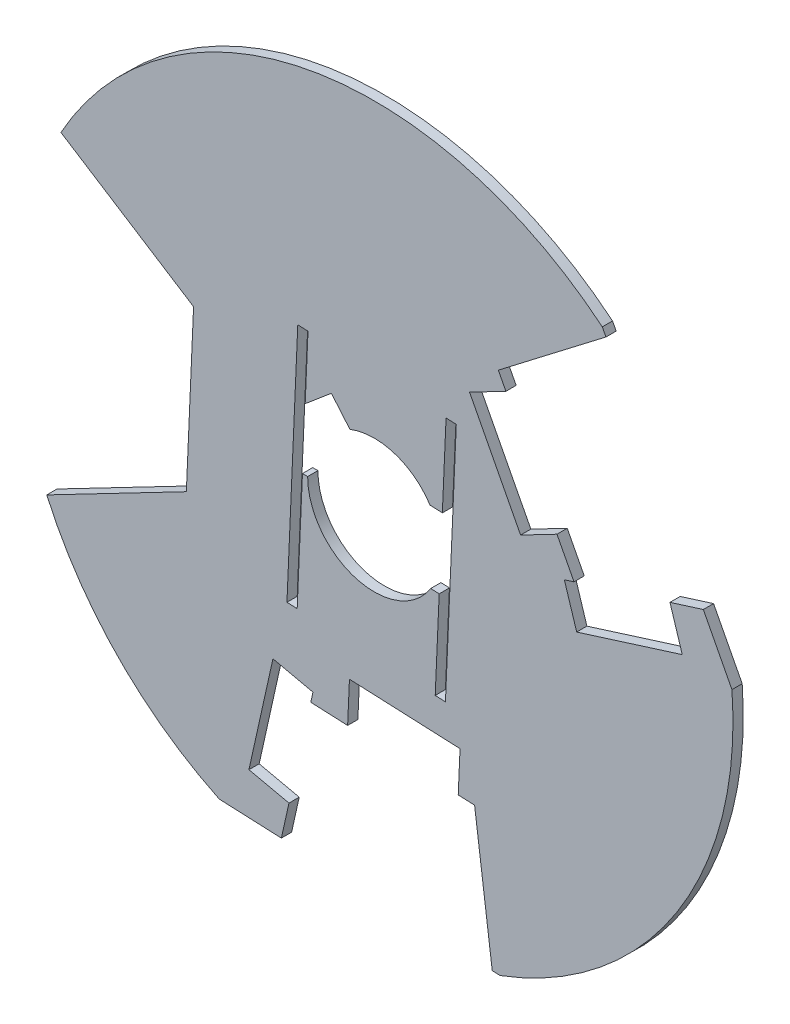
from build123d import *

# Parameters (mm, degrees)
ESQUISSE1_R             = 4.7
BOSS_EXTRU_1_DEPTH      = 5
ENL_V_START             = -10
ENL_V_MAT_EXTRU_1_DEPTH = 10
ENL_V_MAT_EXTRU_2_DEPTH = 10


with BuildPart() as part:
    # Esquisse1 → Boss.-Extru.1 (new body)
    with BuildSketch(Plane.XY):
        with BuildLine():
            Line((174.481446525, 13.461976776), (160.509166102, 40.333250621))
            Line((160.509166102, 40.333250621), (97.428399446, 20.476493551))
            Line((97.428399446, 20.476493551), (60.521806411, 91.454683092))
            Line((60.521806411, 91.454683092), (113.006926452, 131.688824037))
            Line((113.006926452, 131.688824037), (111.232668913, 135.101048724))
            ThreePointArc((111.232668913, 135.101048724), (-147.549372919, 94.096665994), (-75.582309389, -157.836353567))
            Line((-75.582309389, -157.836353567), (-45.324963396, -159.171640695))
            Line((-45.324963396, -159.171640695), (-30.981036128, -94.613715745))
            Line((-30.981036128, -94.613715745), (48.941175647, -98.140763381))
            Line((48.941175647, -98.140763381), (57.542403784, -163.71128113))
            Line((57.542403784, -163.71128113), (61.384605816, -163.880841372))
            ThreePointArc((61.384605816, -163.880841372), (147.549372919, -94.096665994), (174.481446525, 13.461976776))
        make_face()
        with Locations((121.484345953, 17.565156526)):
            Circle(ESQUISSE1_R, mode=Mode.SUBTRACT)
        with Locations((67.796167173, 55.788401035)):
            Circle(ESQUISSE1_R, mode=Mode.SUBTRACT)
        with Locations((14.416088947, -86.607403569)):
            Circle(ESQUISSE1_R, mode=Mode.SUBTRACT)
        with Locations((-45.530301203, -113.99110802)):
            Circle(ESQUISSE1_R, mode=Mode.SUBTRACT)
        with BuildLine():
            Line((-11.899961997, 30.243030676), (-20.91966999, 40.95026504))
            Line((-20.91966999, 40.95026504), (-33.702084088, 30.182438475))
            Line((-33.702084088, 30.182438475), (-32.320681925, 61.484742172))
            Line((-32.320681925, 61.484742172), (-37.315820161, 61.705182649))
            Line((-37.315820161, 61.705182649), (-42.606391614, -58.178135013))
            Line((-42.606391614, -58.178135013), (-37.611253378, -58.398575491))
            Line((-37.611253378, -58.398575491), (-35.034065472, 0))
            Line((-35.034065472, 0), (-32.5, 0))
            ThreePointArc((-32.5, 0), (-8.99280662, -31.231065129), (27.523349483, -17.283380261))
            Line((27.523349483, -17.283380261), (31.660744165, -17.465967651))
            Line((31.660744165, -17.465967651), (29.723210042, -61.370113123))
            Line((29.723210042, -61.370113123), (34.718348278, -61.590553601))
            Line((34.718348278, -61.590553601), (40.008919731, 58.292764062))
            Line((40.008919731, 58.292764062), (35.013781495, 58.513204539))
            Line((35.013781495, 58.513204539), (33.203827505, 17.5))
            Line((33.203827505, 17.5), (27.21544776, 17.764273225))
            ThreePointArc((27.21544776, 17.764273225), (9.877796967, 30.962543937), (-11.899961997, 30.243030676))
        make_face(mode=Mode.SUBTRACT)
    extrude(amount=BOSS_EXTRU_1_DEPTH)

    # Esquisse2 → Enlèv. mat.-Extru.1 (cut)
    with BuildSketch(Plane.XY.offset(5).offset(ENL_V_START)):
        with BuildLine():
            Line((-88.148964429, 43.929034477), (-152.860619324, 85.197600084))
            ThreePointArc((-152.860619324, 85.197600084), (-174.829838257, 7.715416702), (-159.771465705, -71.400831554))
            Line((-159.771465705, -71.400831554), (-91.676012064, -35.993177298))
            Line((-91.676012064, -35.993177298), (-88.148964429, 43.929034477))
        make_face()
    extrude(amount=ENL_V_MAT_EXTRU_1_DEPTH, mode=Mode.SUBTRACT)

    # Esquisse3 → Enlèv. mat.-Extru.2 (cut)
    with BuildSketch(Plane.XY.offset(5)):
        Polygon((40.948954466, -97.788058617), (-12.998538482, -95.407301464), (-12.116776573, -75.42674852), (41.830716375, -77.807505674), align=None)
        Polygon((-49.436008781, -85.46488415), (-29.912121681, -89.802836721), (-41.624593625, -142.517331891), (-61.148480724, -138.179379319), align=None)
        Polygon((64.212465714, 84.356864138), (89.124416013, 36.446586197), (71.379868627, 27.219937939), (46.467918329, 75.130215879), align=None)
        Polygon((98.732765194, -0.080397389), (92.727598771, 18.996761106), (144.235926707, 35.210710447), (150.24109313, 16.133551952), align=None)
    extrude(amount=-ENL_V_MAT_EXTRU_2_DEPTH, mode=Mode.SUBTRACT)


solid = part.part
